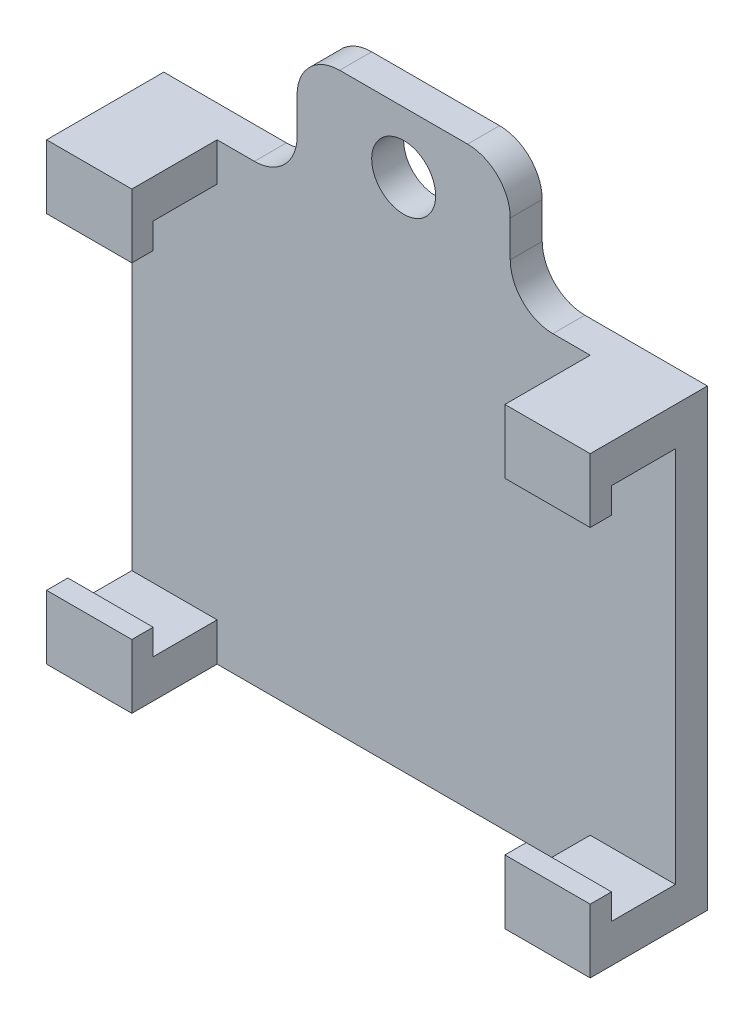
from build123d import *

# Parameters (mm, degrees)
SKETCH1_W             = 25.5
SKETCH1_H             = 32.7
BOSS_EXTRUDE1_DEPTH   = 1.5
SKETCH2_W             = 25.5
SKETCH2_H             = 3
BOSS_EXTRUDE2_DEPTH   = 4
SKETCH3_W             = 25.5
SKETCH3_H             = 3
CUT_EXTRUDE1_DEPTH    = 1.2
SKETCH4_W             = 25.5
SKETCH4_H             = 3
CUT_EXTRUDE2_DEPTH    = 1.2
SKETCH5_R             = 1.5
CUT_EXTRUDE3_DEPTH    = 42.65981277
SKETCH7_W             = 25.5
SKETCH7_H             = 5.7
CUT_EXTRUDE4_DEPTH    = 42.830491271
SKETCH8_W             = 17.5
SKETCH8_H             = 4
CUT_EXTRUDE5_DEPTH    = 38.543308325
SKETCH9_W             = 7.75
SKETCH9_H             = 5.7
CUT_EXTRUDE6_DEPTH    = 42.65981277
FILLET1_R             = 2
BODY_MOVE_COPY1_ANGLE = 90


with BuildPart() as part:
    # Sketch1 → Boss-Extrude1 (new body)
    with BuildSketch(Plane(origin=(0, 0, 0), x_dir=(1, 0, 0), z_dir=(0, 1, 0))):
        with Locations((12.75, 16.35)):
            Rectangle(SKETCH1_W, SKETCH1_H)
    extrude(amount=BOSS_EXTRUDE1_DEPTH)

    # Sketch2 → Boss-Extrude2 (add)
    with BuildSketch(Plane(origin=(0, 1.5, 0), x_dir=(1, 0, 0), z_dir=(0, 1, 0))):
        with Locations((12.75, 25.5)):
            Rectangle(SKETCH2_W, SKETCH2_H)
        with Locations((12.75, 7.2)):
            Rectangle(SKETCH2_W, SKETCH2_H)
    extrude(amount=BOSS_EXTRUDE2_DEPTH)

    # Sketch3 → Cut-Extrude1 (cut)
    with BuildSketch(Plane.XY.offset(-24)):
        with Locations((12.75, 3)):
            Rectangle(SKETCH3_W, SKETCH3_H)
    extrude(amount=-CUT_EXTRUDE1_DEPTH, mode=Mode.SUBTRACT)

    # Sketch4 → Cut-Extrude2 (cut)
    with BuildSketch(Plane(origin=(0, 0, -8.7), x_dir=(-1, 0, 0), z_dir=(0, 0, -1))):
        with Locations((-12.75, 3)):
            Rectangle(SKETCH4_W, SKETCH4_H)
    extrude(amount=-CUT_EXTRUDE2_DEPTH, mode=Mode.SUBTRACT)

    # Sketch5 → Cut-Extrude3 (cut, through all)
    with BuildSketch(Plane(origin=(0, 1.5, 0), x_dir=(1, 0, 0), z_dir=(0, 1, 0))):
        with Locations(Location((12.75, 29.85, 0), (0, 0, 270))):
            Circle(SKETCH5_R)
        with Locations(Location((12.75, 2.85, 0), (0, 0, 270))):
            Circle(SKETCH5_R)
    extrude(amount=-CUT_EXTRUDE3_DEPTH, mode=Mode.SUBTRACT)

    # Sketch7 → Cut-Extrude4 (cut, through all)
    with BuildSketch(Plane(origin=(0, 0, 0), x_dir=(1, 0, 0), z_dir=(0, 1, 0))):
        with Locations((12.75, 2.85)):
            Rectangle(SKETCH7_W, SKETCH7_H)
    extrude(amount=CUT_EXTRUDE4_DEPTH, mode=Mode.SUBTRACT)

    # Sketch8 → Cut-Extrude5 (cut, through all)
    with BuildSketch(Plane.XY.offset(-5.7)):
        with Locations((12.75, 3.5)):
            Rectangle(SKETCH8_W, SKETCH8_H)
    extrude(amount=-CUT_EXTRUDE5_DEPTH, mode=Mode.SUBTRACT)

    # Sketch9 → Cut-Extrude6 (cut, through all)
    with BuildSketch(Plane(origin=(0, 1.5, 0), x_dir=(1, 0, 0), z_dir=(0, 1, 0))):
        with Locations((3.875, 29.85)):
            Rectangle(SKETCH9_W, SKETCH9_H)
        with Locations((21.625, 29.85)):
            Rectangle(SKETCH9_W, SKETCH9_H)
    extrude(amount=-CUT_EXTRUDE6_DEPTH, mode=Mode.SUBTRACT)

    # Fillet1
    fillet1_edges = [part.edges().sort_by_distance(p)[0] for p in [
        (7.75, 0.75, -32.7),
        (7.75, 0.75, -27),
        (17.75, 0.75, -32.7),
        (17.75, 0.75, -27),
    ]]
    fillet(fillet1_edges, radius=FILLET1_R)


with BuildPart() as part_1:
    # Body-Move/Copy1: moved
    add(part.part.rotate(Axis((0, 2.75, -20.7), (1, 0, 0)), BODY_MOVE_COPY1_ANGLE))


solid = part_1.part
